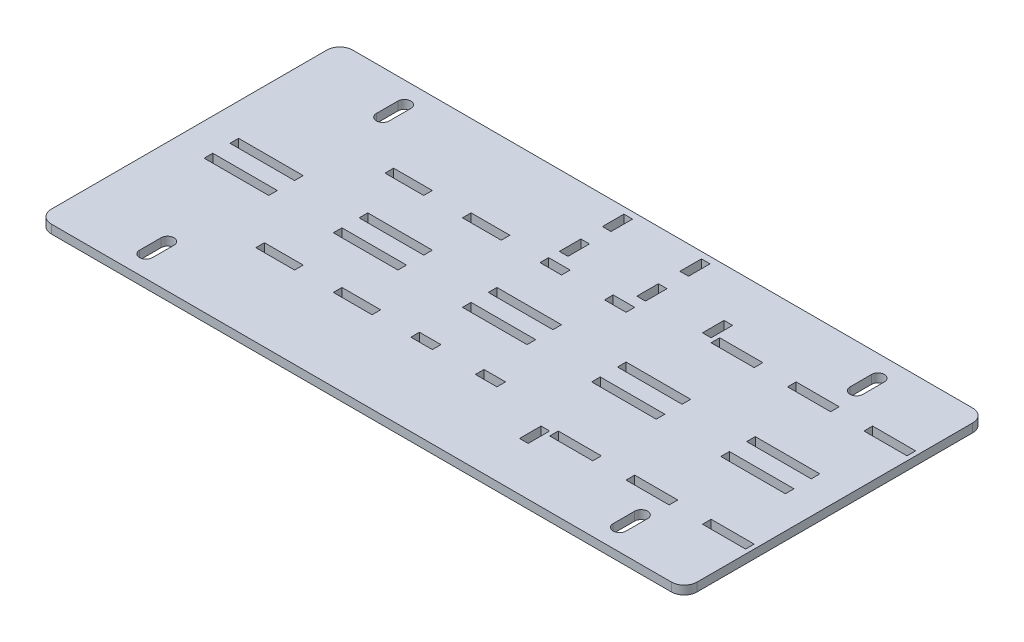
from build123d import *

# Parameters (mm, degrees)
SKETCH1_W           = 300
SKETCH1_H           = 140
BOSS_EXTRUDE1_DEPTH = 2
CUT_EXTRUDE1_REACH  = 167.578
CUT_EXTRUDE2_REACH  = 167.578
SKETCH3_W           = 30
SKETCH3_H           = 4
FILLET1_R           = 6
SKETCH4_W           = 10
SKETCH4_H           = 4
CUT_EXTRUDE3_DEPTH  = 166.577776287
SKETCH5_W           = 4
SKETCH5_H           = 10
CUT_EXTRUDE4_DEPTH  = 166.577776287
SKETCH6_W           = 18
SKETCH6_H           = 4
CUT_EXTRUDE5_DEPTH  = 166.577776287
SKETCH7_W           = 20
SKETCH7_H           = 4
SKETCH7_W_2         = 4
SKETCH7_H_2         = 10
CUT_EXTRUDE6_DEPTH  = 166.577776287


with BuildPart() as part:
    # Sketch1 → Boss-Extrude1 (new, symmetric)
    with BuildSketch(Plane(origin=(0, 0, 0), x_dir=(1, 0, 0), z_dir=(0, 1, 0))):
        Rectangle(SKETCH1_W, SKETCH1_H)
    extrude(amount=BOSS_EXTRUDE1_DEPTH, both=True)

    # Sketch2 → Cut-Extrude1 (cut, up to next)
    with BuildSketch(Plane(origin=(0, 2, 0), x_dir=(1, 0, 0), z_dir=(0, 1, 0)), mode=Mode.PRIVATE) as cut_extrude1_sk1:
        with BuildLine():
            Line((-107, 60), (-107, 50))
            ThreePointArc((-107, 50), (-110, 47), (-113, 50))
            Line((-113, 50), (-113, 60))
            ThreePointArc((-113, 60), (-110, 63), (-107, 60))
        make_face()
    cut_extrude1_tool1 = extrude(cut_extrude1_sk1.sketch, amount=-CUT_EXTRUDE1_REACH, mode=Mode.PRIVATE) & part.part
    # Sketch2 → Cut-Extrude1 (cut, up to next)
    with BuildSketch(Plane(origin=(0, 2, 0), x_dir=(1, 0, 0), z_dir=(0, 1, 0)), mode=Mode.PRIVATE) as cut_extrude1_sk2:
        with BuildLine():
            Line((107, 60), (107, 50))
            ThreePointArc((107, 50), (110, 47), (113, 50))
            Line((113, 50), (113, 60))
            ThreePointArc((113, 60), (110, 63), (107, 60))
        make_face()
    cut_extrude1_tool2 = extrude(cut_extrude1_sk2.sketch, amount=-CUT_EXTRUDE1_REACH, mode=Mode.PRIVATE) & part.part
    # Sketch2 → Cut-Extrude1 (cut, up to next)
    with BuildSketch(Plane(origin=(0, 2, 0), x_dir=(1, 0, 0), z_dir=(0, 1, 0)), mode=Mode.PRIVATE) as cut_extrude1_sk3:
        with BuildLine():
            Line((107, -60), (107, -50))
            ThreePointArc((107, -50), (110, -47), (113, -50))
            Line((113, -50), (113, -60))
            ThreePointArc((113, -60), (110, -63), (107, -60))
        make_face()
    cut_extrude1_tool3 = extrude(cut_extrude1_sk3.sketch, amount=-CUT_EXTRUDE1_REACH, mode=Mode.PRIVATE) & part.part
    # Sketch2 → Cut-Extrude1 (cut, up to next)
    with BuildSketch(Plane(origin=(0, 2, 0), x_dir=(1, 0, 0), z_dir=(0, 1, 0)), mode=Mode.PRIVATE) as cut_extrude1_sk4:
        with BuildLine():
            Line((-107, -60), (-107, -50))
            ThreePointArc((-107, -50), (-110, -47), (-113, -50))
            Line((-113, -50), (-113, -60))
            ThreePointArc((-113, -60), (-110, -63), (-107, -60))
        make_face()
    cut_extrude1_tool4 = extrude(cut_extrude1_sk4.sketch, amount=-CUT_EXTRUDE1_REACH, mode=Mode.PRIVATE) & part.part
    add(cut_extrude1_tool1.solids().sort_by_distance((-110, 2, -55))[0], mode=Mode.SUBTRACT)
    add(cut_extrude1_tool2.solids().sort_by_distance((110, 2, -55))[0], mode=Mode.SUBTRACT)
    add(cut_extrude1_tool3.solids().sort_by_distance((110, 2, 55))[0], mode=Mode.SUBTRACT)
    add(cut_extrude1_tool4.solids().sort_by_distance((-110, 2, 55))[0], mode=Mode.SUBTRACT)

    # Sketch3 → Cut-Extrude2 (cut, up to next)
    with BuildSketch(Plane(origin=(0, 2, 0), x_dir=(1, 0, 0), z_dir=(0, 1, 0)), mode=Mode.PRIVATE) as cut_extrude2_sk1:
        with Locations((-60, 6)):
            Rectangle(SKETCH3_W, SKETCH3_H)
    cut_extrude2_tool1 = extrude(cut_extrude2_sk1.sketch, amount=-CUT_EXTRUDE2_REACH, mode=Mode.PRIVATE) & part.part
    # Sketch3 → Cut-Extrude2 (cut, up to next)
    with BuildSketch(Plane(origin=(0, 2, 0), x_dir=(1, 0, 0), z_dir=(0, 1, 0)), mode=Mode.PRIVATE) as cut_extrude2_sk2:
        with Locations((-120, 6)):
            Rectangle(SKETCH3_W, SKETCH3_H)
    cut_extrude2_tool2 = extrude(cut_extrude2_sk2.sketch, amount=-CUT_EXTRUDE2_REACH, mode=Mode.PRIVATE) & part.part
    # Sketch3 → Cut-Extrude2 (cut, up to next)
    with BuildSketch(Plane(origin=(0, 2, 0), x_dir=(1, 0, 0), z_dir=(0, 1, 0)), mode=Mode.PRIVATE) as cut_extrude2_sk3:
        with Locations((0, 6)):
            Rectangle(SKETCH3_W, SKETCH3_H)
    cut_extrude2_tool3 = extrude(cut_extrude2_sk3.sketch, amount=-CUT_EXTRUDE2_REACH, mode=Mode.PRIVATE) & part.part
    # Sketch3 → Cut-Extrude2 (cut, up to next)
    with BuildSketch(Plane(origin=(0, 2, 0), x_dir=(1, 0, 0), z_dir=(0, 1, 0)), mode=Mode.PRIVATE) as cut_extrude2_sk4:
        with Locations((60, 6)):
            Rectangle(SKETCH3_W, SKETCH3_H)
    cut_extrude2_tool4 = extrude(cut_extrude2_sk4.sketch, amount=-CUT_EXTRUDE2_REACH, mode=Mode.PRIVATE) & part.part
    # Sketch3 → Cut-Extrude2 (cut, up to next)
    with BuildSketch(Plane(origin=(0, 2, 0), x_dir=(1, 0, 0), z_dir=(0, 1, 0)), mode=Mode.PRIVATE) as cut_extrude2_sk5:
        with Locations((120, 6)):
            Rectangle(SKETCH3_W, SKETCH3_H)
    cut_extrude2_tool5 = extrude(cut_extrude2_sk5.sketch, amount=-CUT_EXTRUDE2_REACH, mode=Mode.PRIVATE) & part.part
    # Sketch3 → Cut-Extrude2 (cut, up to next)
    with BuildSketch(Plane(origin=(0, 2, 0), x_dir=(1, 0, 0), z_dir=(0, 1, 0)), mode=Mode.PRIVATE) as cut_extrude2_sk6:
        with Locations((120, -6)):
            Rectangle(SKETCH3_W, SKETCH3_H)
    cut_extrude2_tool6 = extrude(cut_extrude2_sk6.sketch, amount=-CUT_EXTRUDE2_REACH, mode=Mode.PRIVATE) & part.part
    # Sketch3 → Cut-Extrude2 (cut, up to next)
    with BuildSketch(Plane(origin=(0, 2, 0), x_dir=(1, 0, 0), z_dir=(0, 1, 0)), mode=Mode.PRIVATE) as cut_extrude2_sk7:
        with Locations((60, -6)):
            Rectangle(SKETCH3_W, SKETCH3_H)
    cut_extrude2_tool7 = extrude(cut_extrude2_sk7.sketch, amount=-CUT_EXTRUDE2_REACH, mode=Mode.PRIVATE) & part.part
    # Sketch3 → Cut-Extrude2 (cut, up to next)
    with BuildSketch(Plane(origin=(0, 2, 0), x_dir=(1, 0, 0), z_dir=(0, 1, 0)), mode=Mode.PRIVATE) as cut_extrude2_sk8:
        with Locations((0, -6)):
            Rectangle(SKETCH3_W, SKETCH3_H)
    cut_extrude2_tool8 = extrude(cut_extrude2_sk8.sketch, amount=-CUT_EXTRUDE2_REACH, mode=Mode.PRIVATE) & part.part
    # Sketch3 → Cut-Extrude2 (cut, up to next)
    with BuildSketch(Plane(origin=(0, 2, 0), x_dir=(1, 0, 0), z_dir=(0, 1, 0)), mode=Mode.PRIVATE) as cut_extrude2_sk9:
        with Locations((-60, -6)):
            Rectangle(SKETCH3_W, SKETCH3_H)
    cut_extrude2_tool9 = extrude(cut_extrude2_sk9.sketch, amount=-CUT_EXTRUDE2_REACH, mode=Mode.PRIVATE) & part.part
    # Sketch3 → Cut-Extrude2 (cut, up to next)
    with BuildSketch(Plane(origin=(0, 2, 0), x_dir=(1, 0, 0), z_dir=(0, 1, 0)), mode=Mode.PRIVATE) as cut_extrude2_sk10:
        with Locations((-120, -6)):
            Rectangle(SKETCH3_W, SKETCH3_H)
    cut_extrude2_tool10 = extrude(cut_extrude2_sk10.sketch, amount=-CUT_EXTRUDE2_REACH, mode=Mode.PRIVATE) & part.part
    add(cut_extrude2_tool1.solids().sort_by_distance((-60, 2, -6))[0], mode=Mode.SUBTRACT)
    add(cut_extrude2_tool2.solids().sort_by_distance((-120, 2, -6))[0], mode=Mode.SUBTRACT)
    add(cut_extrude2_tool3.solids().sort_by_distance((0, 2, -6))[0], mode=Mode.SUBTRACT)
    add(cut_extrude2_tool4.solids().sort_by_distance((60, 2, -6))[0], mode=Mode.SUBTRACT)
    add(cut_extrude2_tool5.solids().sort_by_distance((120, 2, -6))[0], mode=Mode.SUBTRACT)
    add(cut_extrude2_tool6.solids().sort_by_distance((120, 2, 6))[0], mode=Mode.SUBTRACT)
    add(cut_extrude2_tool7.solids().sort_by_distance((60, 2, 6))[0], mode=Mode.SUBTRACT)
    add(cut_extrude2_tool8.solids().sort_by_distance((0, 2, 6))[0], mode=Mode.SUBTRACT)
    add(cut_extrude2_tool9.solids().sort_by_distance((-60, 2, 6))[0], mode=Mode.SUBTRACT)
    add(cut_extrude2_tool10.solids().sort_by_distance((-120, 2, 6))[0], mode=Mode.SUBTRACT)

    # Fillet1
    fillet1_edges = [part.edges().sort_by_distance(p)[0] for p in [
        (150, 0, -70),
        (150, 0, 70),
        (-150, 0, 70),
        (-150, 0, -70),
    ]]
    fillet(fillet1_edges, radius=FILLET1_R)

    # Sketch4 → Cut-Extrude3 (cut, through all)
    with BuildSketch(Plane(origin=(0, 2, 0), x_dir=(1, 0, 0), z_dir=(0, 1, 0))):
        with Locations((20, 30)):
            Rectangle(SKETCH4_W, SKETCH4_H)
        with Locations((-10, 30)):
            Rectangle(SKETCH4_W, SKETCH4_H)
    cut_extrude3 = extrude(amount=-CUT_EXTRUDE3_DEPTH, mode=Mode.SUBTRACT)

    # Sketch5 → Cut-Extrude4 (cut, through all)
    with BuildSketch(Plane(origin=(0, 2, 0), x_dir=(1, 0, 0), z_dir=(0, 1, 0))):
        with Locations((23, 42)):
            Rectangle(SKETCH5_W, SKETCH5_H)
        with Locations((-13, 42)):
            Rectangle(SKETCH5_W, SKETCH5_H)
        with Locations((-13, 62)):
            Rectangle(SKETCH5_W, SKETCH5_H)
        with Locations((23, 62)):
            Rectangle(SKETCH5_W, SKETCH5_H)
    extrude(amount=-CUT_EXTRUDE4_DEPTH, mode=Mode.SUBTRACT)

    # Sketch6 → Cut-Extrude5 (cut, through all)
    with BuildSketch(Plane(origin=(0, 2, 0), x_dir=(1, 0, 0), z_dir=(0, 1, 0))):
        with Locations((-42, 30)):
            Rectangle(SKETCH6_W, SKETCH6_H)
        with Locations((-78, 30)):
            Rectangle(SKETCH6_W, SKETCH6_H)
    cut_extrude5 = extrude(amount=-CUT_EXTRUDE5_DEPTH, mode=Mode.SUBTRACT)

    # Mirror1: Cut-Extrude3, Cut-Extrude5 across plane
    add(cut_extrude3.mirror(Plane.XY), mode=Mode.SUBTRACT)
    add(cut_extrude5.mirror(Plane.XY), mode=Mode.SUBTRACT)

    # Sketch7 → Cut-Extrude6 (cut, through all)
    with BuildSketch(Plane(origin=(0, 2, 0), x_dir=(1, 0, 0), z_dir=(0, 1, 0))):
        with Locations((67, 37.5)):
            Rectangle(SKETCH7_W, SKETCH7_H)
        with Locations((102.5, 37.5)):
            Rectangle(SKETCH7_W, SKETCH7_H)
        with Locations((138, 37.5)):
            Rectangle(SKETCH7_W, SKETCH7_H)
        with Locations((67, -37.5)):
            Rectangle(SKETCH7_W, SKETCH7_H)
        with Locations((102.5, -37.5)):
            Rectangle(SKETCH7_W, SKETCH7_H)
        with Locations((138, -37.5)):
            Rectangle(SKETCH7_W, SKETCH7_H)
        with Locations((53, 42.5)):
            Rectangle(SKETCH7_W_2, SKETCH7_H_2)
        with Locations((53, -42.5)):
            Rectangle(SKETCH7_W_2, SKETCH7_H_2)
    extrude(amount=-CUT_EXTRUDE6_DEPTH, mode=Mode.SUBTRACT)


solid = part.part
